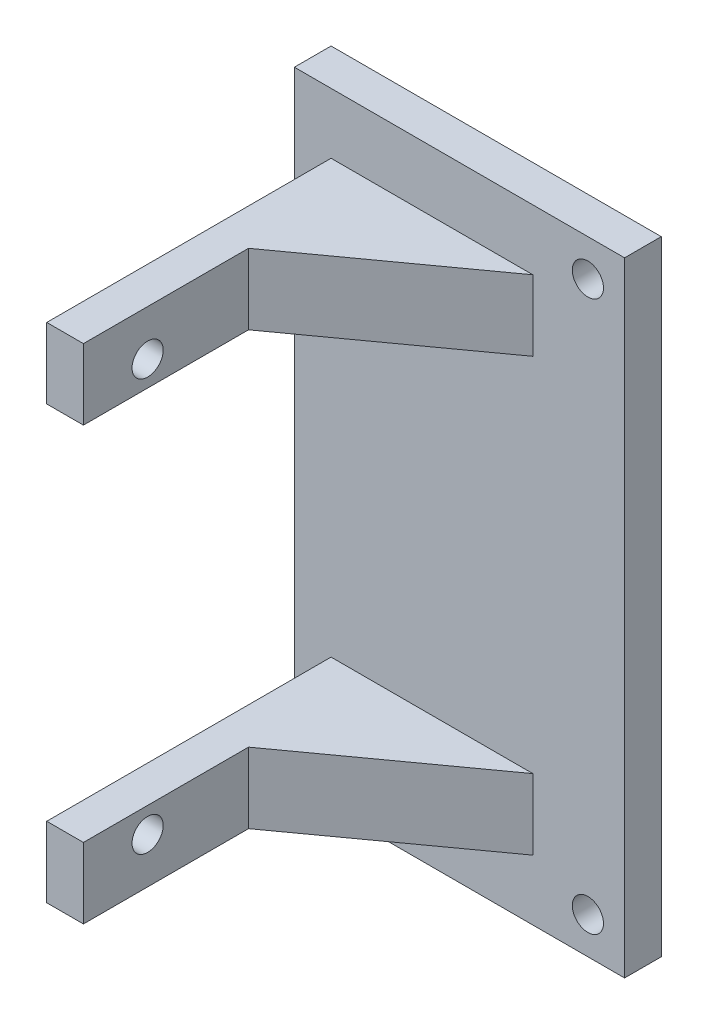
from build123d import *

# Parameters (mm, degrees)
BASE_4MM_START                          = 57
SKETCH_7_W                              = 36
SKETCH_7_H                              = 68
BASE_4MM_DEPTH                          = 4
TWIN_EAR_SUPPORTS_START                 = 61
SKETCH_8_W                              = 4
SKETCH_8_H                              = 7.7
TWIN_EAR_SUPPORTS_DEPTH                 = 31
INTEGRAL_SHORT_GUSSET_27_4_START        = -27.4
INTEGRAL_SHORT_GUSSET_27_4_DEPTH        = 7.7
INTEGRAL_SHORT_GUSSET_19_7_START        = 19.7
INTEGRAL_SHORT_GUSSET_19_7_DEPTH        = 7.7
BASE_M3_CLEARANCE_START                 = 63
SKETCH_11_R                             = 1.7
BASE_M3_CLEARANCE_DEPTH                 = 7
ACTUAL_CAMERA_44P88_PITCH_M3_DEPTH      = 120
ACTUAL_CAMERA_44P88_PITCH_M3_DEPTH_BACK = 120
SKETCH_12_R                             = 1.7


with BuildPart() as part:
    # 草图7 → Base_4mm (new body)
    with BuildSketch(Plane.XY.offset(BASE_4MM_START)):
        with Locations((-66, 0)):
            Rectangle(SKETCH_7_W, SKETCH_7_H)
    extrude(amount=BASE_4MM_DEPTH)

    # 草图8 → Twin_ear_supports (add)
    with BuildSketch(Plane.XY.offset(TWIN_EAR_SUPPORTS_START)):
        with Locations((-78, -23.55)):
            Rectangle(SKETCH_8_W, SKETCH_8_H)
        with Locations((-78, 23.55)):
            Rectangle(SKETCH_8_W, SKETCH_8_H)
    extrude(amount=TWIN_EAR_SUPPORTS_DEPTH)

    # 草图9 → Integral_short_gusset_-27.4 (add)
    with BuildSketch(Plane(origin=(0, 0, 0), x_dir=(1, 0, 0), z_dir=(0, 1, 0)).offset(INTEGRAL_SHORT_GUSSET_27_4_START)):
        Polygon((-76, -61), (-58, -61), (-76, -74), align=None)
    extrude(amount=INTEGRAL_SHORT_GUSSET_27_4_DEPTH)

    # 草图10 → Integral_short_gusset_19.7 (add)
    with BuildSketch(Plane(origin=(0, 0, 0), x_dir=(1, 0, 0), z_dir=(0, 1, 0)).offset(INTEGRAL_SHORT_GUSSET_19_7_START)):
        Polygon((-76, -61), (-58, -61), (-76, -74), align=None)
    extrude(amount=INTEGRAL_SHORT_GUSSET_19_7_DEPTH)

    # 草图11 → Base_M3_clearance (cut)
    with BuildSketch(Plane.XY.offset(BASE_M3_CLEARANCE_START)):
        with Locations((-52, -30)):
            Circle(SKETCH_11_R)
        with Locations((-52, 30)):
            Circle(SKETCH_11_R)
    extrude(amount=-BASE_M3_CLEARANCE_DEPTH, mode=Mode.SUBTRACT)

    # 草图12 → Actual_camera_44p88_pitch_M3 (cut, two sides: drawn at the far end of the back side and taken through both)
    with BuildSketch(Plane(origin=(0, 0, 0), x_dir=(0, 0, -1), z_dir=(1, 0, 0)).offset(-ACTUAL_CAMERA_44P88_PITCH_M3_DEPTH_BACK)):
        with Locations((-85, -22.44)):
            Circle(SKETCH_12_R)
        with Locations((-85, 22.44)):
            Circle(SKETCH_12_R)
    extrude(amount=ACTUAL_CAMERA_44P88_PITCH_M3_DEPTH + ACTUAL_CAMERA_44P88_PITCH_M3_DEPTH_BACK, mode=Mode.SUBTRACT)


solid = part.part
